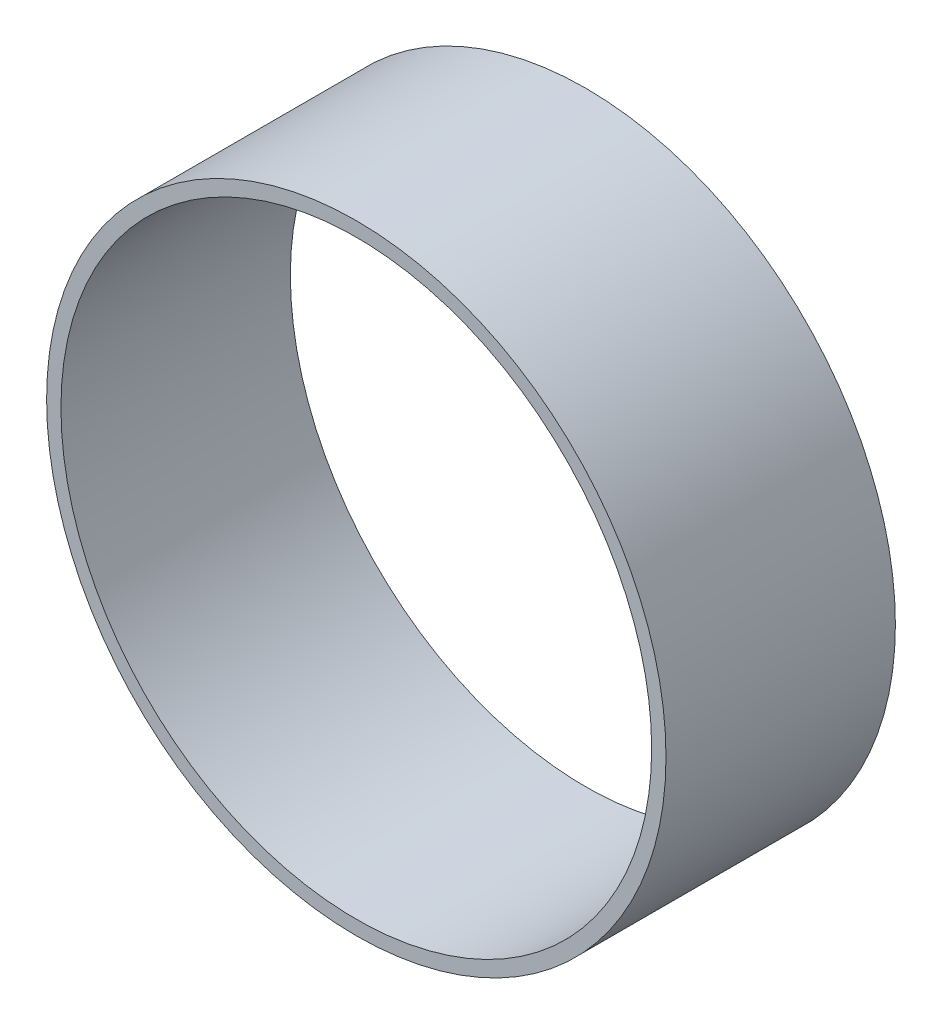
from build123d import *

# Parameters (mm, degrees)
SKETCH_2_R      = 27
SKETCH_2_R_2    = 25.75
EXTRUDE_1_DEPTH = 20


with BuildPart() as part:
    # 草图2 → 凸台-拉伸1 (new body)
    with BuildSketch(Plane.XY):
        Circle(SKETCH_2_R)
        Circle(SKETCH_2_R_2, mode=Mode.SUBTRACT)
    extrude(amount=EXTRUDE_1_DEPTH)


solid = part.part
